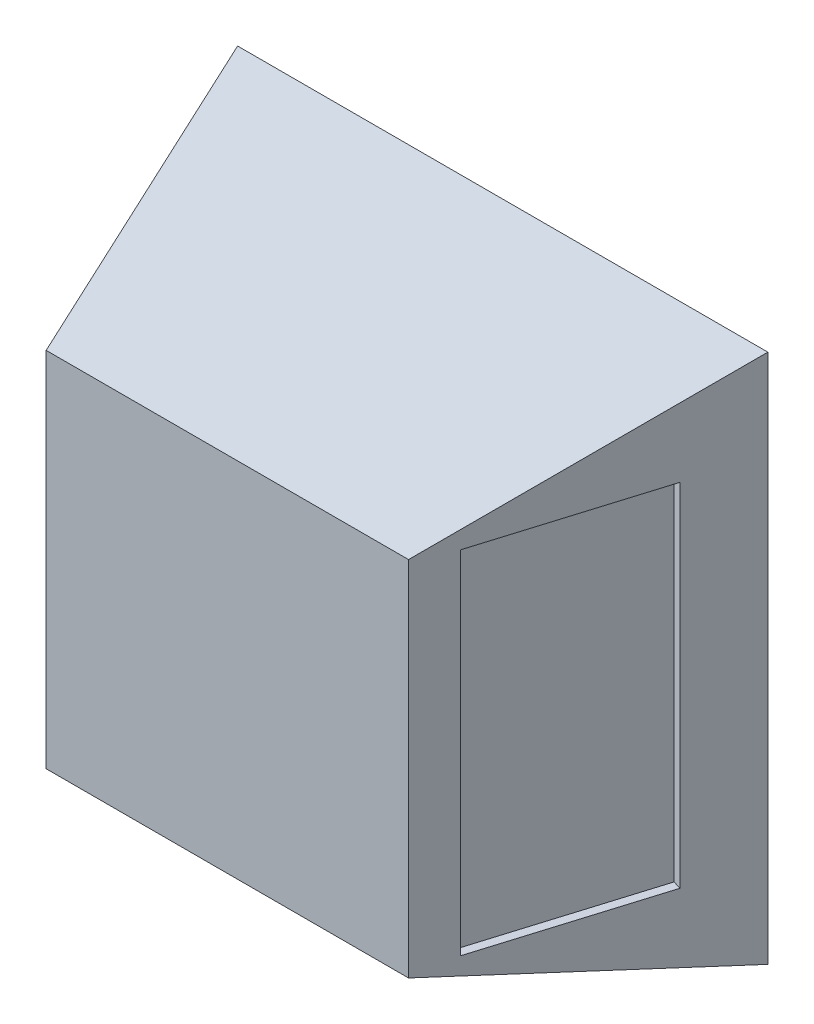
from build123d import *

# Parameters (mm, degrees)
SHELL4_T            = -2.5
SKETCH5_W           = 5.8
SKETCH5_H           = 4
BOSS_EXTRUDE1_DEPTH = 10.9
CUT_EXTRUDE3_DEPTH  = 4
SKETCH7_W           = 12
SKETCH7_H           = 6
CUT_EXTRUDE4_DEPTH  = 0.3


with BuildPart() as part:
    # Sketch1 → Loft2 section 0
    with BuildSketch(Plane.XY):
        with BuildLine():
            Line((-9.05, 9.05), (9.05, 9.05))
            Line((9.05, 9.05), (9.05, -9.05))
            Line((9.05, -9.05), (-9.05, -9.05))
            Line((-9.05, -9.05), (-9.05, 9.05))
        make_face()
    # Sketch2 → Loft2 section 1
    with BuildSketch(Plane.XY.offset(9.4)):
        with BuildLine():
            Line((-6.185, 6.185), (6.185, 6.185))
            Line((6.185, 6.185), (6.185, -6.185))
            Line((6.185, -6.185), (-6.185, -6.185))
            Line((-6.185, -6.185), (-6.185, 6.185))
        make_face()
    loft()

    # Shell4
    shell4_openings = [part.faces().sort_by_distance(p)[0] for p in [
        (0, 0, 0),
    ]]
    offset(amount=SHELL4_T, openings=shell4_openings, kind=Kind.INTERSECTION)

    # Sketch5 → Boss-Extrude1 (add)
    with BuildSketch(Plane.XY.offset(-4)):
        Rectangle(SKETCH5_W, SKETCH5_H)
    extrude(amount=BOSS_EXTRUDE1_DEPTH)

    # Sketch6 → Cut-Extrude3 (cut)
    with BuildSketch(Plane(origin=(0, 0, -4), x_dir=(-1, 0, 0), z_dir=(0, 0, -1))):
        Polygon((0.73, 2.15), (-0.73, 2.15), (-0.73, 0.73), (-2.15, 0.73), (-2.15, -0.73), (-0.73, -0.73), (-0.73, -2.15), (0.73, -2.15), (0.73, -0.73), (2.15, -0.73), (2.15, 0.73), (0.73, 0.73), align=None)
    extrude(amount=-CUT_EXTRUDE3_DEPTH, mode=Mode.SUBTRACT)

    # Sketch7 → Cut-Extrude4 (cut)
    with BuildSketch(Plane(origin=(8.280756947, 0, 2.523869006), x_dir=(0, -1, 0), z_dir=(-0.9565567247121476, 0, -0.29154627832981955))):
        with Locations((0, 2.765838851)):
            Rectangle(SKETCH7_W, SKETCH7_H)
    extrude(amount=CUT_EXTRUDE4_DEPTH, mode=Mode.SUBTRACT)


solid = part.part
